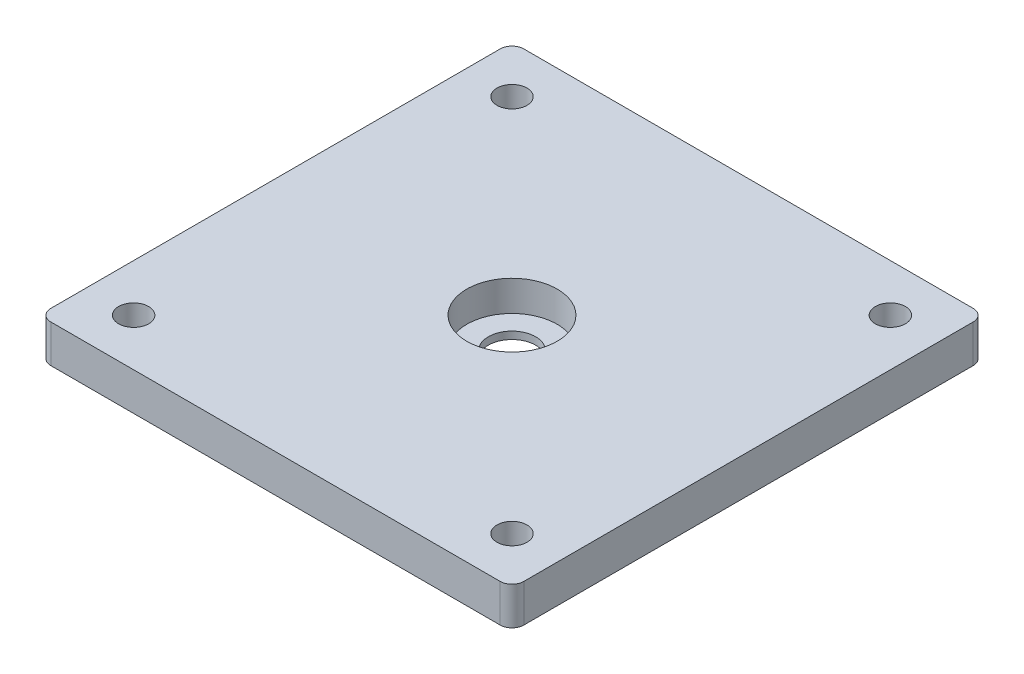
from build123d import *

# Parameters (mm, degrees)
SKETCH1_R           = 12.7
SKETCH1_R_2         = 3.175
BOSS_EXTRUDE1_DEPTH = 10
SKETCH1_3_R         = 12.7
SKETCH1_3_R_2       = 6.35
BOSS_EXTRUDE2_DEPTH = 2.5
SKETCH2_R           = 12.7
BOSS_EXTRUDE3_DEPTH = 10
SKETCH3_R           = 5
CUT_EXTRUDE3_DEPTH  = 10
CUT_EXTRUDE4_START  = -1.45
SKETCH4_R           = 10
CUT_EXTRUDE4_DEPTH  = 5
CUT_EXTRUDE5_DEPTH  = 2
SKETCH7_R           = 10
CUT_EXTRUDE7_DEPTH  = 6.45
BOSS_EXTRUDE4_START = 6.45
SKETCH8_R           = 10
SKETCH8_R_2         = 9.5625
BOSS_EXTRUDE4_DEPTH = 6.45
BOSS_EXTRUDE5_START = -8
BOSS_EXTRUDE5_DEPTH = 8
FILLET1_R           = 2.5


with BuildPart() as part:
    # Sketch1 → Boss-Extrude1 (new body)
    with BuildSketch(Plane(origin=(0, 0, 0), x_dir=(1, 0, 0), z_dir=(0, 1, 0))):
        with BuildLine():
            Line((-41.199040767, 52.757793765), (38.800959233, 52.757793765))
            ThreePointArc((38.800959233, 52.757793765), (45.872027044, 49.828861577), (48.800959233, 42.757793765))
            Line((48.800959233, 42.757793765), (48.800959233, -37.242206235))
            ThreePointArc((48.800959233, -37.242206235), (45.872027044, -44.313274047), (38.800959233, -47.242206235))
            Line((38.800959233, -47.242206235), (-41.199040767, -47.242206235))
            ThreePointArc((-41.199040767, -47.242206235), (-48.270108579, -44.313274047), (-51.199040767, -37.242206235))
            Line((-51.199040767, -37.242206235), (-51.199040767, 42.757793765))
            ThreePointArc((-51.199040767, 42.757793765), (-48.270108579, 49.828861577), (-41.199040767, 52.757793765))
        make_face()
        with Locations(Location((0, 0, 0), (0, 0, 270))):
            Circle(SKETCH1_R, mode=Mode.SUBTRACT)
        with Locations(Location((-41.199040767, 42.757793765, 0), (0, 0, 270))):
            Circle(SKETCH1_R_2, mode=Mode.SUBTRACT)
        with Locations(Location((38.800959233, 42.757793765, 0), (0, 0, 270))):
            Circle(SKETCH1_R_2, mode=Mode.SUBTRACT)
        with Locations(Location((38.800959233, -37.242206235, 0), (0, 0, 270))):
            Circle(SKETCH1_R_2, mode=Mode.SUBTRACT)
        with Locations(Location((-41.199040767, -37.242206235, 0), (0, 0, 270))):
            Circle(SKETCH1_R_2, mode=Mode.SUBTRACT)
    extrude(amount=BOSS_EXTRUDE1_DEPTH)

    # Sketch1<3> → Boss-Extrude2 (add)
    with BuildSketch(Plane(origin=(0, 0, 0), x_dir=(1, 0, 0), z_dir=(0, 1, 0))):
        with Locations(Location((0, 0, 0), (0, 0, 270))):
            Circle(SKETCH1_3_R)
        with Locations(Location((0, 0, 0), (0, 0, 270))):
            Circle(SKETCH1_3_R_2, mode=Mode.SUBTRACT)
    extrude(amount=BOSS_EXTRUDE2_DEPTH)

    # Sketch2 → Boss-Extrude3 (add, through all)
    with BuildSketch(Plane(origin=(0, 10, 0), x_dir=(1, 0, 0), z_dir=(0, 1, 0))):
        Circle(SKETCH2_R)
    extrude(amount=-BOSS_EXTRUDE3_DEPTH)

    # Sketch3 → Cut-Extrude3 (cut)
    with BuildSketch(Plane(origin=(0, 10, 0), x_dir=(1, 0, 0), z_dir=(0, 1, 0))):
        with Locations(Location((-1.199040767, 2.757793765, 0), (0, 0, 270))):
            Circle(SKETCH3_R)
    extrude(amount=-CUT_EXTRUDE3_DEPTH, mode=Mode.SUBTRACT)

    # Sketch4 → Cut-Extrude4 (cut)
    with BuildSketch(Plane(origin=(0, 10, 0), x_dir=(1, 0, 0), z_dir=(0, 1, 0)).offset(CUT_EXTRUDE4_START)):
        with Locations(Location((-1.199040767, 2.757793765, 0), (0, 0, 270))):
            Circle(SKETCH4_R)
    extrude(amount=-CUT_EXTRUDE4_DEPTH, mode=Mode.SUBTRACT)

    # Sketch6 → Cut-Extrude5 (cut)
    with BuildSketch(Plane.XZ):
        with BuildLine():
            Line((48.800959233, -42.757793765), (48.800959233, 37.242206235))
            ThreePointArc((48.800959233, 37.242206235), (45.872027044, 44.313274047), (38.800959233, 47.242206235))
            Line((38.800959233, 47.242206235), (-41.199040767, 47.242206235))
            ThreePointArc((-41.199040767, 47.242206235), (-48.270108579, 44.313274047), (-51.199040767, 37.242206235))
            Line((-51.199040767, 37.242206235), (-51.199040767, -42.757793765))
            ThreePointArc((-51.199040767, -42.757793765), (-48.270108579, -49.828861577), (-41.199040767, -52.757793765))
            Line((-41.199040767, -52.757793765), (38.800959233, -52.757793765))
            ThreePointArc((38.800959233, -52.757793765), (45.872027044, -49.828861577), (48.800959233, -42.757793765))
        make_face()
    extrude(amount=-CUT_EXTRUDE5_DEPTH, mode=Mode.SUBTRACT)

    # Sketch7 → Cut-Extrude7 (cut)
    with BuildSketch(Plane(origin=(0, 10, 0), x_dir=(1, 0, 0), z_dir=(0, 1, 0))):
        with Locations(Location((-1.199040767, 2.757793765, 0), (0, 0, 270))):
            Circle(SKETCH7_R)
    extrude(amount=-CUT_EXTRUDE7_DEPTH, mode=Mode.SUBTRACT)

    # Sketch8 → Boss-Extrude4 (add)
    with BuildSketch(Plane(origin=(0, 3.55, 0), x_dir=(1, 0, 0), z_dir=(0, 1, 0)).offset(BOSS_EXTRUDE4_START)):
        with Locations((-1.199040767, 2.757793765)):
            Circle(SKETCH8_R)
        with Locations(Location((-1.199040767, 2.757793765, 0), (0, 0, 270))):
            Circle(SKETCH8_R_2, mode=Mode.SUBTRACT)
    extrude(amount=-BOSS_EXTRUDE4_DEPTH)

    # Sketch9 → Boss-Extrude5 (add)
    with BuildSketch(Plane(origin=(0, 10, 0), x_dir=(1, 0, 0), z_dir=(0, 1, 0)).offset(BOSS_EXTRUDE5_START)):
        with BuildLine():
            Line((-51.199040767, 42.757793765), (-51.199040767, 52.757793765))
            Line((-51.199040767, 52.757793765), (-41.199040767, 52.757793765))
            ThreePointArc((-41.199040767, 52.757793765), (-48.270108579, 49.828861577), (-51.199040767, 42.757793765))
        make_face()
        with BuildLine():
            Line((38.800959233, 52.757793765), (48.800959233, 52.757793765))
            Line((48.800959233, 52.757793765), (48.800959233, 42.757793765))
            ThreePointArc((48.800959233, 42.757793765), (45.872027044, 49.828861577), (38.800959233, 52.757793765))
        make_face()
        with BuildLine():
            Line((-51.199040767, -37.242206235), (-51.199040767, -47.242206235))
            Line((-51.199040767, -47.242206235), (-41.199040767, -47.242206235))
            ThreePointArc((-41.199040767, -47.242206235), (-48.270108579, -44.313274047), (-51.199040767, -37.242206235))
        make_face()
        with BuildLine():
            Line((48.800959233, -37.242206235), (48.800959233, -47.242206235))
            Line((48.800959233, -47.242206235), (38.800959233, -47.242206235))
            ThreePointArc((38.800959233, -47.242206235), (45.872027044, -44.313274047), (48.800959233, -37.242206235))
        make_face()
    extrude(amount=BOSS_EXTRUDE5_DEPTH)

    # Fillet1
    fillet1_edges = [part.edges().sort_by_distance(p)[0] for p in [
        (-51.199040767, 6, -52.757793765),
        (48.800959233, 6, -52.757793765),
        (48.800959233, 6, 47.242206235),
        (-51.199040767, 6, 47.242206235),
    ]]
    fillet(fillet1_edges, radius=FILLET1_R)


solid = part.part
